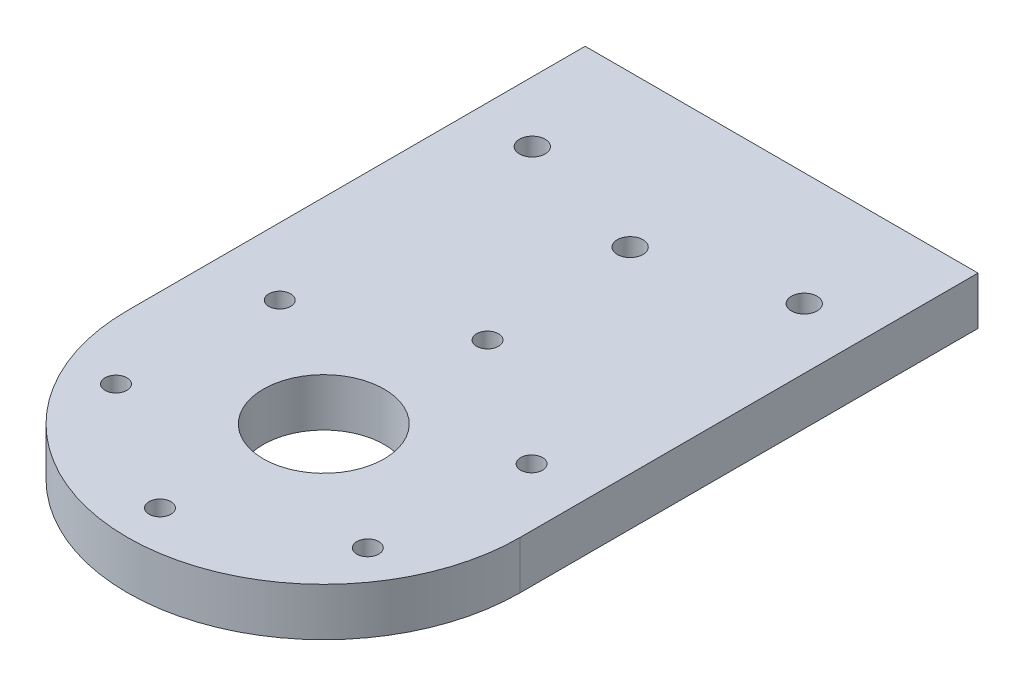
from build123d import *

# Parameters (mm, degrees)
PARED_A_MOTOR_J5_START           = 50.525
CROQUIS1_W                       = 52
CROQUIS1_H                       = 60.6
PARED_A_MOTOR_J5_DEPTH           = 6.35
PARED_A_MOTOR_J5_REDONDEO_START  = 50.525
CROQUIS2_R                       = 26
PARED_A_MOTOR_J5_REDONDEO_DEPTH  = 6.35
BARRENOS_M5_START                = 50.525
CROQUIS3_R                       = 1.45
CROQUIS3_R_2                     = 8
BARRENOS_M5_DEPTH                = 6.35
ROSCA_M3_ESCUADRAS_START         = 50.525
CROQUIS4_R                       = 1.25
ROSCA_M3_ESCUADRAS_DEPTH         = 6.35
PASADORES_D4_START               = 275.95
CROQUIS5_R                       = 2
PASADORES_D4_DEPTH               = 8
ROSCA_M3_BASES_CINCHO_START      = 50.525
CROQUIS6_R                       = 1.25
ROSCA_M3_BASES_CINCHO_DEPTH      = 6.35
PASO_M3_ESCUADRAS_TUERCA_START   = 50.525
CROQUIS7_R                       = 1.7
PASO_M3_ESCUADRAS_TUERCA_DEPTH   = 6.35
PASO_M3_BASE_CINCHO_TUERCA_START = 50.525
CROQUIS8_R                       = 1.7
PASO_M3_BASE_CINCHO_TUERCA_DEPTH = 6.35


with BuildPart() as part:
    # Croquis1 → Pared_A_motor_J5 (new body)
    with BuildSketch(Plane(origin=(0, 0, 0), x_dir=(1, 0, 0), z_dir=(0, 1, 0)).offset(PARED_A_MOTOR_J5_START)):
        with Locations((152.4, -306.25)):
            Rectangle(CROQUIS1_W, CROQUIS1_H)
    extrude(amount=PARED_A_MOTOR_J5_DEPTH)

    # Croquis2 → Pared_A_motor_J5_redondeo (add)
    with BuildSketch(Plane(origin=(0, 0, 0), x_dir=(1, 0, 0), z_dir=(0, 1, 0)).offset(PARED_A_MOTOR_J5_REDONDEO_START)):
        with Locations((152.4, -336.55)):
            Circle(CROQUIS2_R)
    extrude(amount=PARED_A_MOTOR_J5_REDONDEO_DEPTH)

    # Croquis3 → Barrenos_M5 (cut)
    with BuildSketch(Plane(origin=(0, 0, 0), x_dir=(1, 0, 0), z_dir=(0, 1, 0)).offset(BARRENOS_M5_START)):
        with Locations(Location((169.514381197, -347.834855172, 0), (0, 0, 270))):
            Circle(CROQUIS3_R)
        with Locations(Location((151.184219342, -357.013916472, 0), (0, 0, 270))):
            Circle(CROQUIS3_R)
        with Locations(Location((134.069838145, -345.729061301, 0), (0, 0, 270))):
            Circle(CROQUIS3_R)
        with Locations(Location((135.285618803, -325.265144828, 0), (0, 0, 270))):
            Circle(CROQUIS3_R)
        with Locations(Location((153.615780658, -316.086083528, 0), (0, 0, 270))):
            Circle(CROQUIS3_R)
        with Locations(Location((170.730161855, -327.370938699, 0), (0, 0, 270))):
            Circle(CROQUIS3_R)
        with Locations(Location((152.4, -336.55, 0), (0, 0, 270))):
            Circle(CROQUIS3_R_2)
    extrude(amount=BARRENOS_M5_DEPTH, mode=Mode.SUBTRACT)

    # Croquis4 → Rosca_M3_escuadras (cut)
    with BuildSketch(Plane(origin=(0, 0, 0), x_dir=(1, 0, 0), z_dir=(0, 1, 0)).offset(ROSCA_M3_ESCUADRAS_START)):
        with Locations(Location((134.4, -290.95, 0), (0, 0, 270))):
            Circle(CROQUIS4_R)
        with Locations(Location((170.4, -290.95, 0), (0, 0, 270))):
            Circle(CROQUIS4_R)
    extrude(amount=ROSCA_M3_ESCUADRAS_DEPTH, mode=Mode.SUBTRACT)

    # Croquis5 → Pasadores_D4 (cut)
    with BuildSketch(Plane.XY.offset(PASADORES_D4_START)):
        with Locations((130.4, 53.7)):
            Circle(CROQUIS5_R)
        with Locations((174.4, 53.7)):
            Circle(CROQUIS5_R)
    extrude(amount=PASADORES_D4_DEPTH, mode=Mode.SUBTRACT)

    # Croquis6 → Rosca_M3_bases_cincho (cut)
    with BuildSketch(Plane(origin=(0, 0, 0), x_dir=(1, 0, 0), z_dir=(0, 1, 0)).offset(ROSCA_M3_BASES_CINCHO_START)):
        with Locations(Location((152.4, -296, 0), (0, 0, 270))):
            Circle(CROQUIS6_R)
    extrude(amount=ROSCA_M3_BASES_CINCHO_DEPTH, mode=Mode.SUBTRACT)

    # Croquis7 → Paso_M3_escuadras_tuerca (cut)
    with BuildSketch(Plane(origin=(0, 0, 0), x_dir=(1, 0, 0), z_dir=(0, 1, 0)).offset(PASO_M3_ESCUADRAS_TUERCA_START)):
        with Locations(Location((134.4, -290.95, 0), (0, 0, 270))):
            Circle(CROQUIS7_R)
        with Locations(Location((170.4, -290.95, 0), (0, 0, 270))):
            Circle(CROQUIS7_R)
    extrude(amount=PASO_M3_ESCUADRAS_TUERCA_DEPTH, mode=Mode.SUBTRACT)

    # Croquis8 → Paso_M3_base_cincho_tuerca (cut)
    with BuildSketch(Plane(origin=(0, 0, 0), x_dir=(1, 0, 0), z_dir=(0, 1, 0)).offset(PASO_M3_BASE_CINCHO_TUERCA_START)):
        with Locations(Location((152.4, -296, 0), (0, 0, 270))):
            Circle(CROQUIS8_R)
    extrude(amount=PASO_M3_BASE_CINCHO_TUERCA_DEPTH, mode=Mode.SUBTRACT)


solid = part.part
